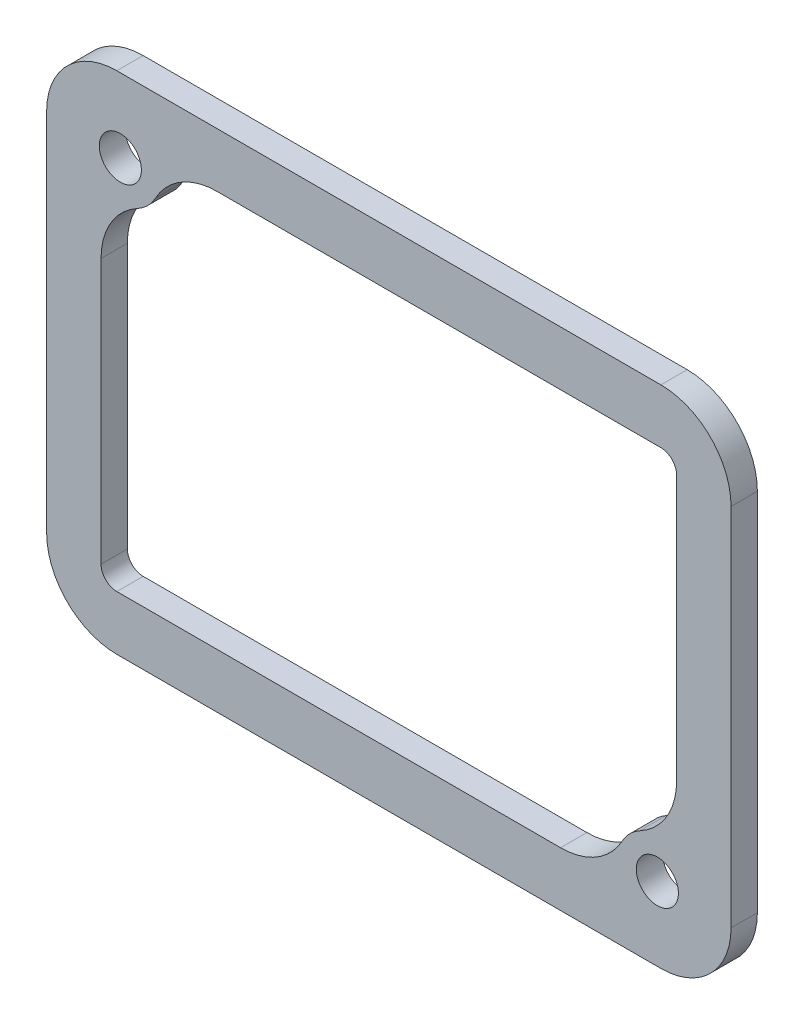
from build123d import *

# Parameters (mm, degrees)
AUFSATZ_LINEAR_AUSTRAGEN1_DEPTH = 1.5
SCHNITT_LINEAR_AUSTRAGEN3_DEPTH = 25.287033578
SKIZZE8_R                       = 1.2
SCHNITT_LINEAR_AUSTRAGEN4_DEPTH = 25.287033578


with BuildPart() as part:
    # Skizze1 → Aufsatz-Linear austragen1 (new body)
    with BuildSketch(Plane.XY):
        with BuildLine():
            Line((15.5, -14.4), (-15.5, -14.4))
            ThreePointArc((-15.5, -14.4), (-18.328427125, -13.228427125), (-19.5, -10.4))
            Line((-19.5, -10.4), (-19.5, 10.4))
            ThreePointArc((-19.5, 10.4), (-18.328427125, 13.228427125), (-15.5, 14.4))
            Line((-15.5, 14.4), (15.5, 14.4))
            ThreePointArc((15.5, 14.4), (18.328427125, 13.228427125), (19.5, 10.4))
            Line((19.5, 10.4), (19.5, -10.4))
            ThreePointArc((19.5, -10.4), (18.328427125, -13.228427125), (15.5, -14.4))
        make_face()
    extrude(amount=AUFSATZ_LINEAR_AUSTRAGEN1_DEPTH)

    # Skizze2 → Schnitt-Linear austragen3 (cut, through all)
    with BuildSketch(Plane.XY.offset(1.5)):
        with BuildLine():
            Line((15.5, 11.3), (-9.786857257, 11.3))
            ThreePointArc((-9.786857257, 11.3), (-11.832490505, 10.737351395), (-13.302637407, 9.207692308))
            ThreePointArc((-13.302637407, 9.207692308), (-13.732233047, 8.632233047), (-14.307692308, 8.202637407))
            ThreePointArc((-14.307692308, 8.202637407), (-15.837351395, 6.732490505), (-16.4, 4.686857257))
            Line((-16.4, 4.686857257), (-16.4, -10.4))
            ThreePointArc((-16.4, -10.4), (-16.136396103, -11.036396103), (-15.5, -11.3))
            Line((-15.5, -11.3), (9.786857257, -11.3))
            ThreePointArc((9.786857257, -11.3), (11.832490505, -10.737351395), (13.302637407, -9.207692308))
            ThreePointArc((13.302637407, -9.207692308), (13.732233047, -8.632233047), (14.307692308, -8.202637407))
            ThreePointArc((14.307692308, -8.202637407), (15.837351395, -6.732490505), (16.4, -4.686857257))
            Line((16.4, -4.686857257), (16.4, 10.4))
            ThreePointArc((16.4, 10.4), (16.136396103, 11.036396103), (15.5, 11.3))
        make_face()
    extrude(amount=-SCHNITT_LINEAR_AUSTRAGEN3_DEPTH, mode=Mode.SUBTRACT)

    # Skizze8 → Schnitt-Linear austragen4 (cut, through all)
    with BuildSketch(Plane.XY.offset(1.5)):
        with Locations((-15.3, 10.2)):
            Circle(SKIZZE8_R)
        with Locations((15.3, -10.2)):
            Circle(SKIZZE8_R)
    extrude(amount=-SCHNITT_LINEAR_AUSTRAGEN4_DEPTH, mode=Mode.SUBTRACT)


solid = part.part
